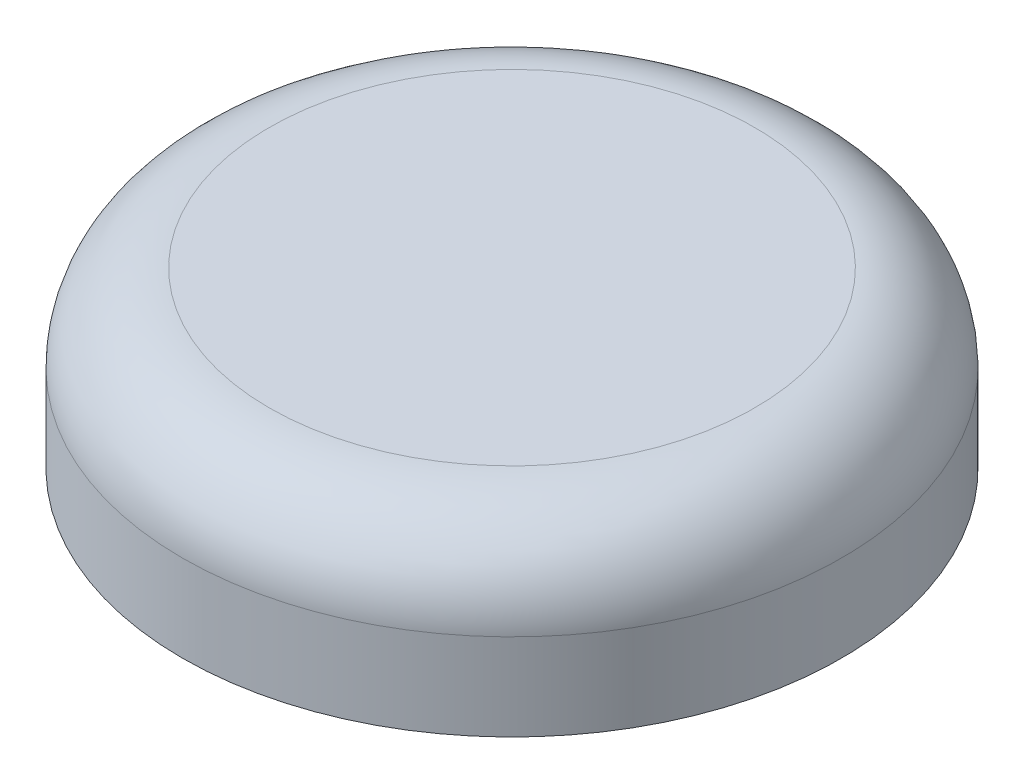
from build123d import *

# Parameters (mm, degrees)
SKETCH1_R                       = 28.5
BOSS_EXTRUDE1_DEPTH             = 15
FILLET1_R                       = 7.5
F_32_0_116_DIAMETER_HOLE4_D     = 2.9464
F_32_0_116_DIAMETER_HOLE4_DEPTH = 3
F_32_0_116_DIAMETER_HOLE4_TIP   = 0.885187864


with BuildPart() as part:
    # Sketch1 → Boss-Extrude1 (new body)
    with BuildSketch(Plane(origin=(0, 0, 0), x_dir=(1, 0, 0), z_dir=(0, 1, 0))):
        with Locations(Location((0, 0, 0), (0, 0, 270))):
            Circle(SKETCH1_R)
    extrude(amount=BOSS_EXTRUDE1_DEPTH)

    # Fillet1
    fillet1_edges = [part.edges().sort_by_distance(p)[0] for p in [
        (0, 15, -28.5),
    ]]
    fillet(fillet1_edges, radius=FILLET1_R)

    # #32 (0.116) Diameter Hole4
    with Locations(Plane(origin=(0, 0, 0), x_dir=(-1, 0, 0), z_dir=(0, -1, 0))):
        with Locations((-16.25, 16.25), (16.25, 16.25), (16.25, -16.25), (-16.25, -16.25)):
            Hole(F_32_0_116_DIAMETER_HOLE4_D / 2, depth=F_32_0_116_DIAMETER_HOLE4_DEPTH)
            with Locations((0, 0, -(F_32_0_116_DIAMETER_HOLE4_DEPTH + F_32_0_116_DIAMETER_HOLE4_TIP / 2))):  # 118° drill point
                Cone(0, F_32_0_116_DIAMETER_HOLE4_D / 2, F_32_0_116_DIAMETER_HOLE4_TIP, mode=Mode.SUBTRACT)


solid = part.part
